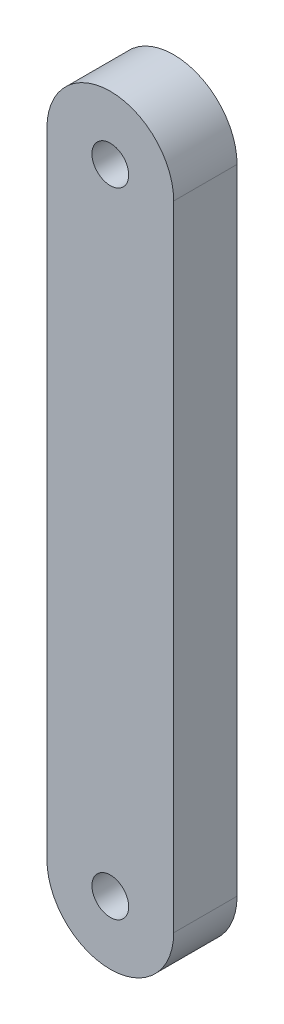
from build123d import *

# Parameters (mm, degrees)
BOSS_EXTRUDE1_DEPTH    = 5
M2_5_CLEARANCE_HOLE1_D = 2.9


with BuildPart() as part:
    # Sketch1 → Boss-Extrude1 (new body)
    with BuildSketch(Plane.XY):
        with BuildLine():
            Line((5, 25), (5, -25))
            ThreePointArc((5, -25), (0, -30), (-5, -25))
            Line((-5, -25), (-5, 25))
            ThreePointArc((-5, 25), (0, 30), (5, 25))
        make_face()
    extrude(amount=BOSS_EXTRUDE1_DEPTH)

    # M2.5 Clearance Hole1 (through all)
    with Locations(Plane.XY.offset(5)):
        with Locations((0, 25), (0, -25)):
            Hole(M2_5_CLEARANCE_HOLE1_D / 2)


solid = part.part
